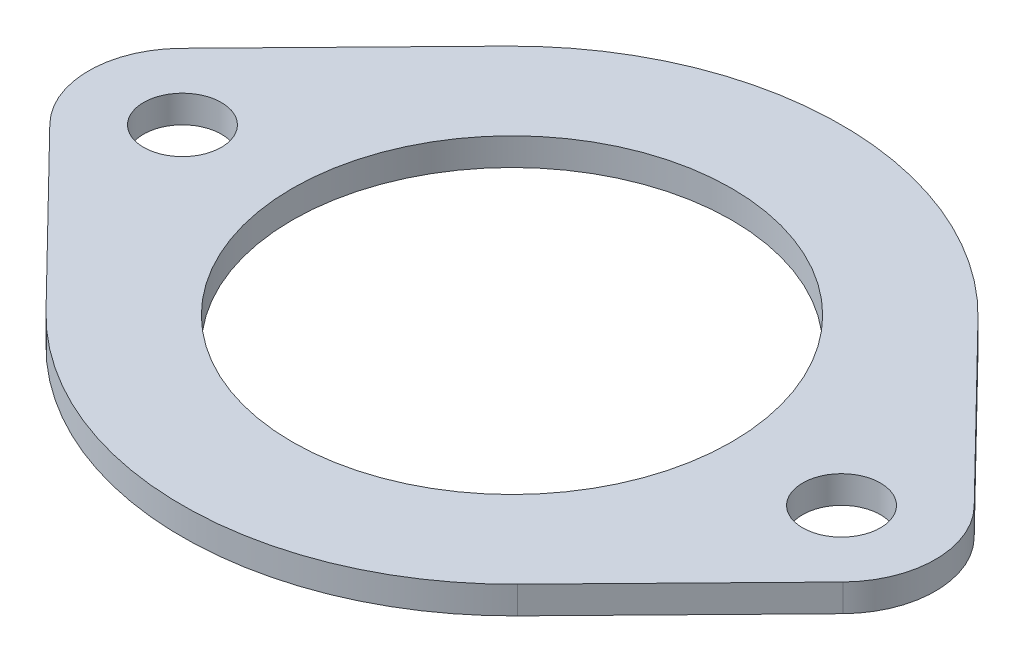
from build123d import *

# Parameters (mm, degrees)
SKETCH1_R           = 15.6845
SKETCH1_R_2         = 2.2479
BOSS_EXTRUDE1_DEPTH = 1.5875
SKETCH2_R           = 15.6845
SKETCH2_R_2         = 12.7
BOSS_EXTRUDE2_DEPTH = 1.5875


with BuildPart() as part:
    # Sketch1 → Boss-Extrude1 (new body)
    with BuildSketch(Plane(origin=(0, 0, 0), x_dir=(1, 0, 0), z_dir=(0, 1, 0))):
        with BuildLine():
            Line((-22.929181133, 3.78943243), (-13.6271, 13.311823526))
            ThreePointArc((-13.6271, 13.311823526), (0, 19.05), (13.6271, 13.311823526))
            Line((13.6271, 13.311823526), (22.929181133, 3.78943243))
            ThreePointArc((22.929181133, 3.78943243), (24.4729, 0), (22.929181133, -3.78943243))
            Line((22.929181133, -3.78943243), (13.6271, -13.311823526))
            ThreePointArc((13.6271, -13.311823526), (0, -19.05), (-13.6271, -13.311823526))
            Line((-13.6271, -13.311823526), (-22.929181133, -3.78943243))
            ThreePointArc((-22.929181133, -3.78943243), (-24.4729, 0), (-22.929181133, 3.78943243))
        make_face()
        with Locations(Location((0, 0, 0), (0, 0, 270))):
            Circle(SKETCH1_R, mode=Mode.SUBTRACT)
        with Locations(Location((-19.05, 0, 0), (0, 0, 270))):
            Circle(SKETCH1_R_2, mode=Mode.SUBTRACT)
        with Locations(Location((19.05, 0, 0), (0, 0, 270))):
            Circle(SKETCH1_R_2, mode=Mode.SUBTRACT)
    extrude(amount=BOSS_EXTRUDE1_DEPTH)

    # Sketch2 → Boss-Extrude2 (add)
    with BuildSketch(Plane.XZ):
        Circle(SKETCH2_R)
        with Locations(Location((0, 0, 0), (0, 0, 270))):
            Circle(SKETCH2_R_2, mode=Mode.SUBTRACT)
    extrude(amount=-BOSS_EXTRUDE2_DEPTH)


solid = part.part
